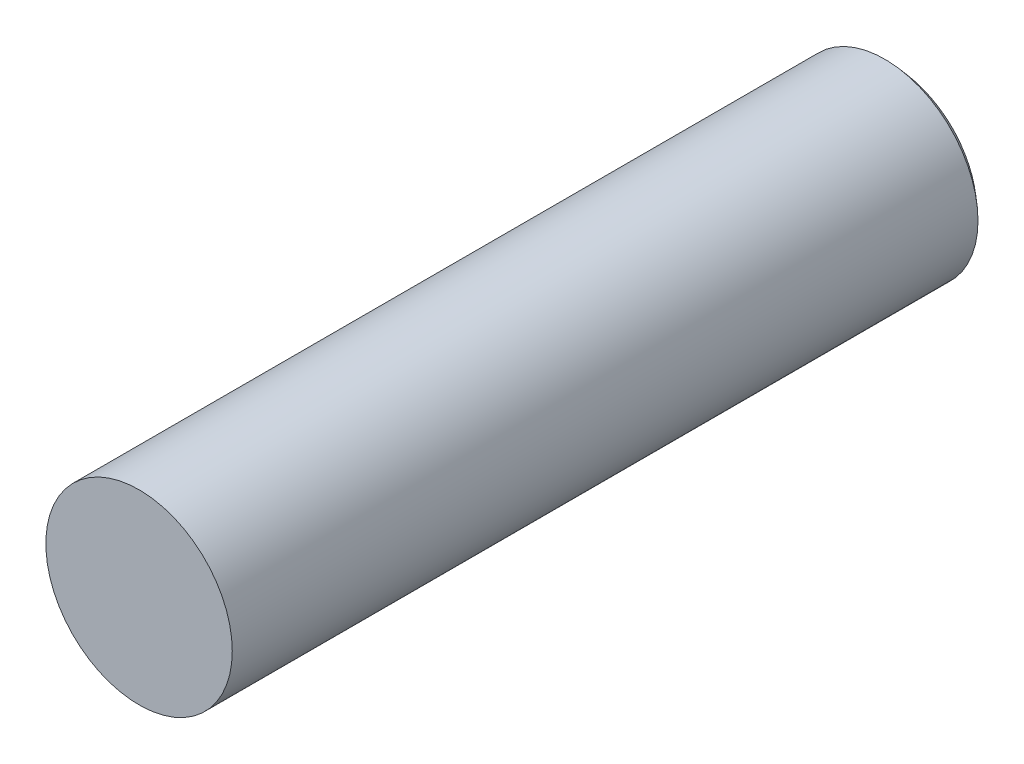
from build123d import *

# Parameters (mm, degrees)
SKETCH2_R           = 250
BOSS_EXTRUDE1_DEPTH = 2000


with BuildPart() as part:
    # Sketch2 → Boss-Extrude1 (new body)
    with BuildSketch(Plane.XY):
        Circle(SKETCH2_R)
    extrude(amount=BOSS_EXTRUDE1_DEPTH)

    # Sketch7 → Revolve1 (revolve)
    with BuildSketch(Plane(origin=(0, 0, 0), x_dir=(1, 0, 0), z_dir=(0, 1, 0))):
        with BuildLine():
            Line((0, 0), (0, 100))
            ThreePointArc((0, 100), (134.629120178, 74.072800446), (250, 0))
            Line((250, 0), (0, 0))
        make_face()
    revolve(axis=Axis((0, 0, 0), (0, 0, -1)))


solid = part.part
